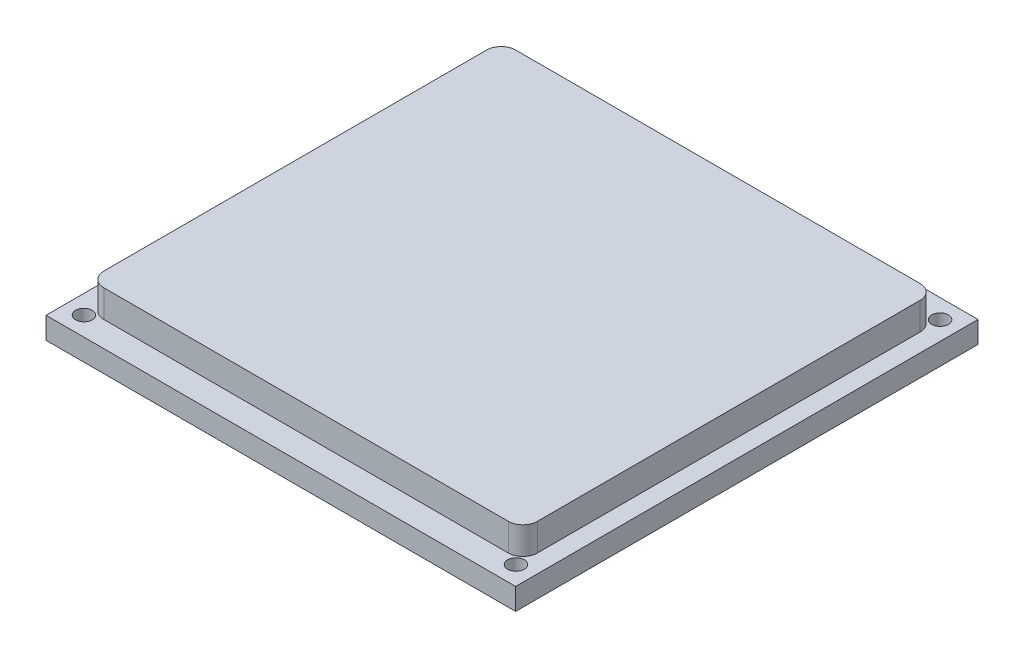
from build123d import *

# Parameters (mm, degrees)
SKETCH1_W           = 65
SKETCH1_H           = 64
SKETCH1_R           = 1.15
BOSS_EXTRUDE1_DEPTH = 3
BOSS_EXTRUDE2_DEPTH = 3.8


with BuildPart() as part:
    # Sketch1 → Boss-Extrude1 (new body)
    with BuildSketch(Plane(origin=(0, 0, 0), x_dir=(1, 0, 0), z_dir=(0, 1, 0))):
        with Locations((-2.334951456, -14.330097087)):
            Rectangle(SKETCH1_W, SKETCH1_H)
        with Locations(Location((-32.234951456, 15.019902913, 0), (0, 0, 270))):
            Circle(SKETCH1_R, mode=Mode.SUBTRACT)
        with Locations(Location((27.565048544, 15.019902913, 0), (0, 0, 270))):
            Circle(SKETCH1_R, mode=Mode.SUBTRACT)
        with Locations(Location((-32.234951456, -43.680097087, 0), (0, 0, 270))):
            Circle(SKETCH1_R, mode=Mode.SUBTRACT)
        with Locations(Location((27.565048544, -43.680097087, 0), (0, 0, 270))):
            Circle(SKETCH1_R, mode=Mode.SUBTRACT)
    extrude(amount=BOSS_EXTRUDE1_DEPTH)

    # Sketch2 → Boss-Extrude2 (add)
    with BuildSketch(Plane(origin=(0, 3, 0), x_dir=(1, 0, 0), z_dir=(0, 1, 0))):
        with BuildLine():
            Line((-30.334951456, 14.169902913), (25.665048544, 14.169902913))
            ThreePointArc((25.665048544, 14.169902913), (27.079262106, 13.584116475), (27.665048544, 12.169902913))
            Line((27.665048544, 12.169902913), (27.665048544, -40.830097087))
            ThreePointArc((27.665048544, -40.830097087), (27.079262106, -42.24431065), (25.665048544, -42.830097087))
            Line((25.665048544, -42.830097087), (-30.334951456, -42.830097087))
            ThreePointArc((-30.334951456, -42.830097087), (-31.749165019, -42.24431065), (-32.334951456, -40.830097087))
            Line((-32.334951456, -40.830097087), (-32.334951456, 12.169902913))
            ThreePointArc((-32.334951456, 12.169902913), (-31.749165019, 13.584116475), (-30.334951456, 14.169902913))
        make_face()
    extrude(amount=BOSS_EXTRUDE2_DEPTH)


solid = part.part
